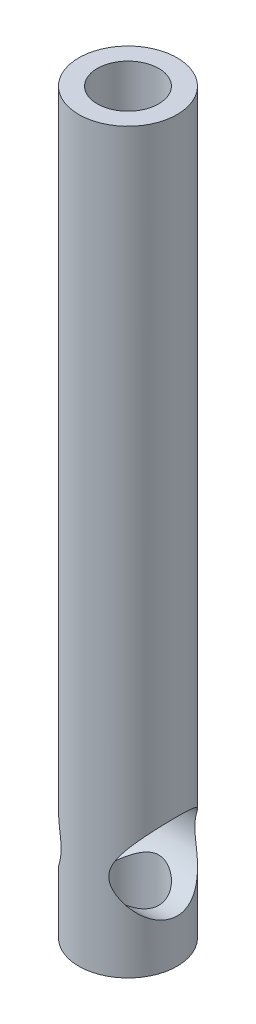
from build123d import *

# Parameters (mm, degrees)
SKETCH1_R                           = 20
SKETCH1_R_2                         = 12.5
BOSS_EXTRUDE1_DEPTH                 = 300
CUT_EXTRUDE1_REACH                  = 303.33
CUT_EXTRUDE1_END_RADIUS             = 20
SKETCH2_R                           = 17.5
CUT_EXTRUDE1_DIRECTION_2_REACH      = 303.33
CUT_EXTRUDE1_DIRECTION_2_END_RADIUS = 20


with BuildPart() as part:
    # Sketch1 → Boss-Extrude1 (new body)
    with BuildSketch(Plane(origin=(0, 0, 0), x_dir=(1, 0, 0), z_dir=(0, 1, 0))):
        with Locations(Location((0, 0, 0), (0, 0, 270))):
            Circle(SKETCH1_R)
        with Locations(Location((0, 0, 0), (0, 0, 270))):
            Circle(SKETCH1_R_2, mode=Mode.SUBTRACT)
    extrude(amount=BOSS_EXTRUDE1_DEPTH)

    # Cut-Extrude1: up to this cylinder (the profile starts inside it)
    cut_extrude1_end = Plane(origin=(0, 35.217075, 0), z_dir=(0, -1, 0)) * Cylinder(CUT_EXTRUDE1_END_RADIUS, 647.66, mode=Mode.PRIVATE)
    # Sketch2 → Cut-Extrude1 (cut, up to the surface)
    with BuildSketch(Plane(origin=(0, 0, 0), x_dir=(0, 0, -1), z_dir=(1, 0, 0)), mode=Mode.PRIVATE) as cut_extrude1_sk1:
        with Locations((0, 35.217075193)):
            Circle(SKETCH2_R)
    cut_extrude1_tool1 = extrude(cut_extrude1_sk1.sketch, amount=-CUT_EXTRUDE1_REACH, mode=Mode.PRIVATE) & cut_extrude1_end
    add(cut_extrude1_tool1.solids().sort_by_distance((0, 35.217075, 0))[0], mode=Mode.SUBTRACT)

    # Cut-Extrude1 direction 2: up to this cylinder (the profile starts inside it)
    cut_extrude1_direction_2_end = Plane(origin=(0, 35.217075, 0), z_dir=(0, -1, 0)) * Cylinder(CUT_EXTRUDE1_DIRECTION_2_END_RADIUS, 647.66, mode=Mode.PRIVATE)
    # Sketch2 → Cut-Extrude1 direction 2 (cut, up to the surface)
    with BuildSketch(Plane(origin=(0, 0, 0), x_dir=(0, 0, -1), z_dir=(1, 0, 0)), mode=Mode.PRIVATE) as cut_extrude1_direction_2_sk1:
        with Locations((0, 35.217075193)):
            Circle(SKETCH2_R)
    cut_extrude1_direction_2_tool1 = extrude(cut_extrude1_direction_2_sk1.sketch, amount=CUT_EXTRUDE1_DIRECTION_2_REACH, mode=Mode.PRIVATE) & cut_extrude1_direction_2_end
    add(cut_extrude1_direction_2_tool1.solids().sort_by_distance((0, 35.217075, 0))[0], mode=Mode.SUBTRACT)


solid = part.part
